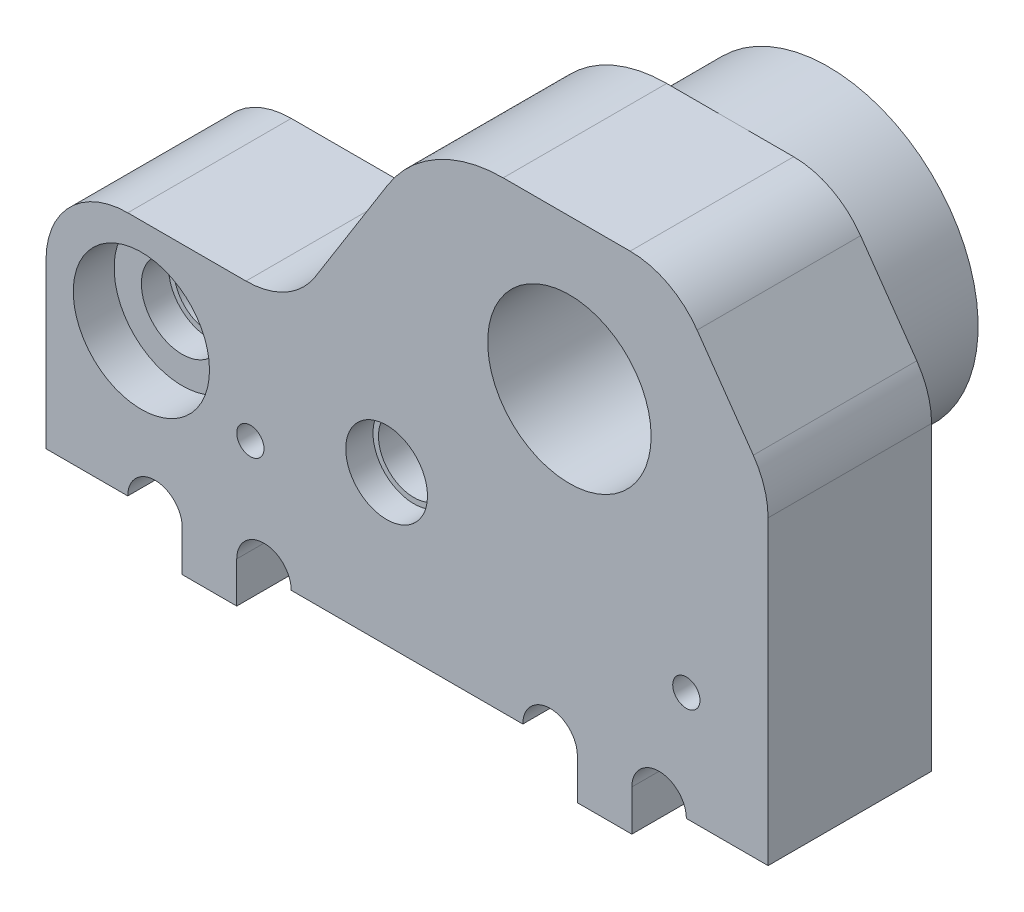
from build123d import *

# Parameters (mm, degrees)
SKETCH1_W                       = 26.5
SKETCH1_H                       = 6
BOSS_EXTRUDE1_DEPTH             = 17
SKETCH2_R                       = 1.5
CUT_EXTRUDE1_DEPTH              = 1
SKETCH3_R                       = 1.3
CUT_EXTRUDE2_DEPTH              = 32.878676259
SKETCH4_R                       = 3
CUT_EXTRUDE3_DEPTH              = 33.050741021
SKETCH5_R                       = 2.5
CUT_EXTRUDE4_DEPTH              = 1.5
SKETCH6_R                       = 1.5
CUT_EXTRUDE8_DEPTH              = 1
SKETCH7_R                       = 1.3
CUT_EXTRUDE9_DEPTH              = 32.678068123
CUT_EXTRUDE10_START             = -1
SKETCH8_R                       = 2.5
CUT_EXTRUDE10_DEPTH             = 1
CUT_EXTRUDE11_START             = -1
SKETCH9_R                       = 1.5
CUT_EXTRUDE11_DEPTH             = 1
SKETCH10_R                      = 5.5
SKETCH10_R_2                    = 3
BOSS_EXTRUDE2_DEPTH             = 3.5
SKETCH11_R                      = 3
SKETCH11_R_2                    = 1.3
BOSS_EXTRUDE4_DEPTH             = 2
CUT_EXTRUDE12_START             = -1
SKETCH12_R                      = 1.5
CUT_EXTRUDE12_DEPTH             = 1
SKETCH17_W                      = 2
SKETCH17_H                      = 6
BOSS_EXTRUDE6_DEPTH             = 1.5
SKETCH18_R                      = 1
CUT_EXTRUDE17_DEPTH             = 33.050741021
CHAMFER2_SIZE                   = 5
CHAMFER2_SIZE2                  = 3.5
FILLET11_R                      = 3
BOSS_EXTRUDE7_DEPTH             = 2
CUT_EXTRUDE19_DEPTH             = 33.050741021
FILLET13_R                      = 5
FILLET14_R                      = 3
FILLET15_R                      = 3
SKIZZE1_R                       = 0.5
SCHNITT_LINEAR_AUSTRAGEN1_DEPTH = 33.050741021


with BuildPart() as part:
    # Sketch1 → Boss-Extrude1 (new body)
    with BuildSketch(Plane(origin=(0, 0, 0), x_dir=(1, 0, 0), z_dir=(0, 1, 0))):
        with Locations((13.25, 3)):
            Rectangle(SKETCH1_W, SKETCH1_H)
    extrude(amount=BOSS_EXTRUDE1_DEPTH)

    # Sketch2 → Cut-Extrude1 (cut)
    with BuildSketch(Plane.XY):
        with Locations((12.5, 5.5)):
            Circle(SKETCH2_R)
    extrude(amount=-CUT_EXTRUDE1_DEPTH, mode=Mode.SUBTRACT)

    # Sketch3 → Cut-Extrude2 (cut, through all)
    with BuildSketch(Plane.XY.offset(-1)):
        with Locations((12.5, 5.5)):
            Circle(SKETCH3_R)
    extrude(amount=-CUT_EXTRUDE2_DEPTH, mode=Mode.SUBTRACT)

    # Sketch4 → Cut-Extrude3 (cut, through all)
    with BuildSketch(Plane.XY):
        with Locations((19.208203932, 11.5)):
            Circle(SKETCH4_R)
    extrude(amount=-CUT_EXTRUDE3_DEPTH, mode=Mode.SUBTRACT)

    # Sketch5 → Cut-Extrude4 (cut)
    with BuildSketch(Plane.XY):
        with Locations((3.5, 5.5)):
            Circle(SKETCH5_R)
    extrude(amount=-CUT_EXTRUDE4_DEPTH, mode=Mode.SUBTRACT)

    # Sketch6 → Cut-Extrude8 (cut)
    with BuildSketch(Plane.XY.offset(-1.5)):
        with Locations((3.5, 5.5)):
            Circle(SKETCH6_R)
    extrude(amount=-CUT_EXTRUDE8_DEPTH, mode=Mode.SUBTRACT)

    # Sketch7 → Cut-Extrude9 (cut, through all)
    with BuildSketch(Plane.XY.offset(-2.5)):
        with Locations((3.5, 5.5)):
            Circle(SKETCH7_R)
    extrude(amount=-CUT_EXTRUDE9_DEPTH, mode=Mode.SUBTRACT)

    # Sketch8 → Cut-Extrude10 (cut)
    with BuildSketch(Plane(origin=(0, 0, -6), x_dir=(-1, 0, 0), z_dir=(0, 0, -1)).offset(CUT_EXTRUDE10_START)):
        with Locations(Location((-3.5, 5.5, 0), (0, 0, 180))):
            Circle(SKETCH8_R)
    extrude(amount=CUT_EXTRUDE10_DEPTH, mode=Mode.SUBTRACT)

    # Sketch9 → Cut-Extrude11 (cut)
    with BuildSketch(Plane(origin=(0, 0, -5), x_dir=(-1, 0, 0), z_dir=(0, 0, -1)).offset(CUT_EXTRUDE11_START)):
        with Locations(Location((-3.5, 5.5, 0), (0, 0, 180))):
            Circle(SKETCH9_R)
    extrude(amount=CUT_EXTRUDE11_DEPTH, mode=Mode.SUBTRACT)

    # Sketch10 → Boss-Extrude2 (add)
    with BuildSketch(Plane(origin=(0, 0, -6), x_dir=(-1, 0, 0), z_dir=(0, 0, -1))):
        with Locations(Location((-19.208203932, 11.5, 0), (0, 0, 90))):
            Circle(SKETCH10_R)
        with Locations(Location((-19.208203932, 11.5, 0), (0, 0, 180))):
            Circle(SKETCH10_R_2, mode=Mode.SUBTRACT)
    extrude(amount=BOSS_EXTRUDE2_DEPTH)

    # Sketch11 → Boss-Extrude4 (add)
    with BuildSketch(Plane(origin=(0, 0, -6), x_dir=(-1, 0, 0), z_dir=(0, 0, -1))):
        with Locations(Location((-12.5, 5.5, 0), (0, 0, 180))):
            Circle(SKETCH11_R)
        with Locations(Location((-12.5, 5.5, 0), (0, 0, 180))):
            Circle(SKETCH11_R_2, mode=Mode.SUBTRACT)
    extrude(amount=BOSS_EXTRUDE4_DEPTH)

    # Sketch12 → Cut-Extrude12 (cut)
    with BuildSketch(Plane(origin=(0, 0, -8), x_dir=(-1, 0, 0), z_dir=(0, 0, -1)).offset(CUT_EXTRUDE12_START)):
        with Locations(Location((-12.5, 5.5, 0), (0, 0, 180))):
            Circle(SKETCH12_R)
    extrude(amount=CUT_EXTRUDE12_DEPTH, mode=Mode.SUBTRACT)

    # Sketch17 → Boss-Extrude6 (add)
    with BuildSketch(Plane.XZ):
        with Locations((6, -3)):
            Rectangle(SKETCH17_W, SKETCH17_H)
        with Locations((20.5, -3)):
            Rectangle(SKETCH17_W, SKETCH17_H)
    extrude(amount=BOSS_EXTRUDE6_DEPTH)

    # Sketch18 → Cut-Extrude17 (cut, through all)
    with BuildSketch(Plane(origin=(0, 0, -6), x_dir=(-1, 0, 0), z_dir=(0, 0, -1))):
        with Locations((-22.5, 0)):
            Circle(SKETCH18_R)
        with Locations((-18.5, 0)):
            Circle(SKETCH18_R)
        with Locations((-8, 0)):
            Circle(SKETCH18_R)
        with Locations((-4, 0)):
            Circle(SKETCH18_R)
    extrude(amount=-CUT_EXTRUDE17_DEPTH, mode=Mode.SUBTRACT)

    # Chamfer2
    chamfer2_edges = [part.edges().sort_by_distance(p)[0] for p in [
        (26.5, 17, -3),
    ]]
    chamfer2_side = [part.faces().sort_by_distance(p)[0] for p in [
        (26.5, 8.5, -3),
    ]]
    chamfer(chamfer2_edges, length=CHAMFER2_SIZE, length2=CHAMFER2_SIZE2, reference=chamfer2_side[0])

    # Fillet11
    fillet11_edges = [part.edges().sort_by_distance(p)[0] for p in [
        (23, 17, -3),
        (26.5, 12, -3),
    ]]
    fillet(fillet11_edges, radius=FILLET11_R)

    # Sketch19 → Boss-Extrude7 (add)
    with BuildSketch(Plane(origin=(0, 0, -6), x_dir=(-1, 0, 0), z_dir=(0, 0, -1))):
        with BuildLine():
            Line((-14.547099294, 14.419606745), (-9.957579288, 7.09251277))
            ThreePointArc((-9.957579288, 7.09251277), (-14.736067977, 7.5), (-13.800160725, 2.796376119))
            Line((-13.800160725, 2.796376119), (-21.591831928, 6.543356218))
            ThreePointArc((-21.591831928, 6.543356218), (-15.108745974, 7.833333333), (-14.547099294, 14.419606745))
        make_face()
    extrude(amount=BOSS_EXTRUDE7_DEPTH)

    # Sketch20 → Cut-Extrude19 (cut, through all)
    with BuildSketch(Plane(origin=(0, 0, -6), x_dir=(-1, 0, 0), z_dir=(0, 0, -1))):
        Polygon((0, 17), (-14.011012575, 17), (-9, 9), (0, 9), align=None)
    extrude(amount=-CUT_EXTRUDE19_DEPTH, mode=Mode.SUBTRACT)

    # Fillet13
    fillet13_edges = [part.edges().sort_by_distance(p)[0] for p in [
        (14.011012575, 17, -3),
    ]]
    fillet(fillet13_edges, radius=FILLET13_R)

    # Fillet14
    fillet14_edges = [part.edges().sort_by_distance(p)[0] for p in [
        (9, 9, -3),
    ]]
    fillet(fillet14_edges, radius=FILLET14_R)

    # Fillet15
    fillet15_edges = [part.edges().sort_by_distance(p)[0] for p in [
        (0, 9, -3),
    ]]
    fillet(fillet15_edges, radius=FILLET15_R)

    # Skizze1 → Schnitt-Linear austragen1 (cut, through all)
    with BuildSketch(Plane(origin=(0, 0, -6), x_dir=(-1, 0, 0), z_dir=(0, 0, -1))):
        with Locations((-23.5, 4)):
            Circle(SKIZZE1_R)
        with Locations((-7.5, 4)):
            Circle(SKIZZE1_R)
    extrude(amount=-SCHNITT_LINEAR_AUSTRAGEN1_DEPTH, mode=Mode.SUBTRACT)


solid = part.part
